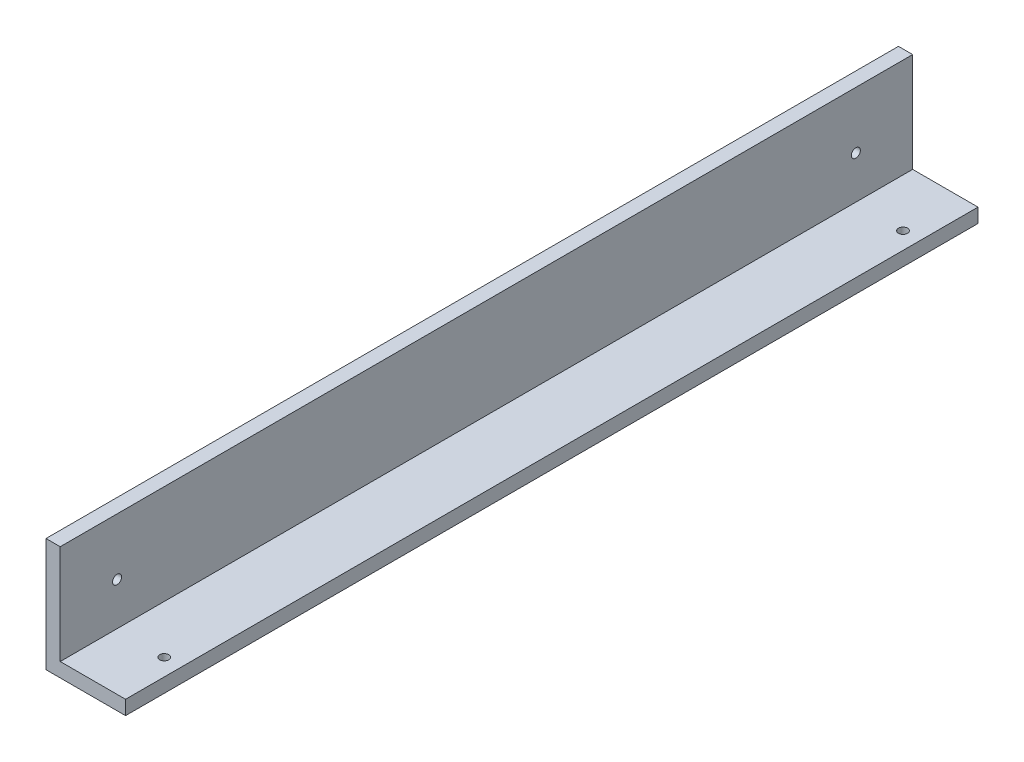
from build123d import *

# Parameters (mm, degrees)
BOSS_EXTRUDE1_DEPTH    = 381
F_10_32_TAPPED_HOLE5_D = 4.0386
F_10_32_TAPPED_HOLE6_D = 4.0386


with BuildPart() as part:
    # Sketch1 → Boss-Extrude1 (new body)
    with BuildSketch(Plane.XY):
        Polygon((0, 0), (0, 50.8), (6.35, 50.8), (6.35, 6.35), (35.56, 6.35), (35.56, 0), align=None)
    extrude(amount=BOSS_EXTRUDE1_DEPTH)

    # #10-32 Tapped Hole5 (through all)
    with Locations(Plane(origin=(6.35, 0, 0), x_dir=(0, 0, -1), z_dir=(1, 0, 0))):
        with Locations((-355.6, 25.4), (-25.4, 25.4)):
            Hole(F_10_32_TAPPED_HOLE5_D / 2)

    # #10-32 Tapped Hole6 (through all)
    with Locations(Plane(origin=(0, 6.35, 0), x_dir=(-1, 0, 0), z_dir=(0, 1, 0))):
        with Locations((-27.94, 356.095307591), (-27.94, 25.895307591)):
            Hole(F_10_32_TAPPED_HOLE6_D / 2)


solid = part.part
